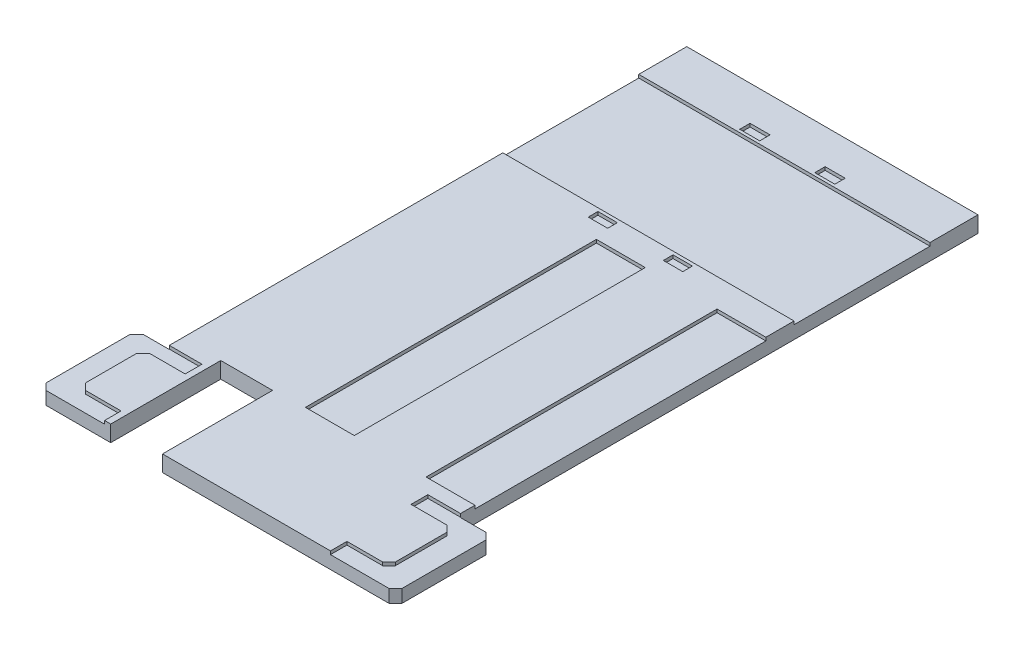
from build123d import *

# Parameters (mm, degrees)
SKETCH1_W           = 90
SKETCH1_H           = 190
BOSS_EXTRUDE1_DEPTH = 5
SKETCH2_W           = 10
SKETCH2_H           = 30
BOSS_EXTRUDE2_DEPTH = 5
CHAMFER1_SIZE       = 2
SKETCH3_W           = 16
SKETCH3_H           = 34
CUT_EXTRUDE1_DEPTH  = 50
SKETCH4_W           = 90
SKETCH4_H           = 42
CUT_EXTRUDE2_DEPTH  = 1
CUT_EXTRUDE5_START  = 5
SKETCH5_W           = 6
SKETCH5_H           = 3
CUT_EXTRUDE5_DEPTH  = 1
SKETCH6_W           = 6.2
SKETCH6_H           = 3.2
CUT_EXTRUDE6_DEPTH  = 1
SKETCH7_W           = 15.1
SKETCH7_H           = 89.916335477
CUT_EXTRUDE7_DEPTH  = 1
CUT_EXTRUDE8_DEPTH  = 1


with BuildPart() as part:
    # Sketch1 → Boss-Extrude1 (new body)
    with BuildSketch(Plane(origin=(0, 0, 0), x_dir=(1, 0, 0), z_dir=(0, 1, 0))):
        Rectangle(SKETCH1_W, SKETCH1_H)
    extrude(amount=BOSS_EXTRUDE1_DEPTH)

    # Sketch2 → Boss-Extrude2 (add)
    with BuildSketch(Plane(origin=(0, 0, 0), x_dir=(1, 0, 0), z_dir=(0, 1, 0))):
        with Locations((-50, -80)):
            Rectangle(SKETCH2_W, SKETCH2_H)
        with Locations((50, -80)):
            Rectangle(SKETCH2_W, SKETCH2_H)
    extrude(amount=BOSS_EXTRUDE2_DEPTH)

    # Chamfer1
    chamfer1_edges = [part.edges().sort_by_distance(p)[0] for p in [
        (-55, 2.5, 65),
        (-55, 2.5, 95),
        (55, 2.5, 95),
        (55, 2.5, 65),
    ]]
    chamfer(chamfer1_edges, length=CHAMFER1_SIZE)

    # Sketch3 → Cut-Extrude1 (cut)
    with BuildSketch(Plane(origin=(0, 5, 0), x_dir=(1, 0, 0), z_dir=(0, 1, 0))):
        with Locations((-25, -78)):
            Rectangle(SKETCH3_W, SKETCH3_H)
    extrude(amount=-CUT_EXTRUDE1_DEPTH, mode=Mode.SUBTRACT)

    # Sketch4 → Cut-Extrude2 (cut)
    with BuildSketch(Plane(origin=(0, 5, 0), x_dir=(1, 0, 0), z_dir=(0, 1, 0))):
        with Locations((0, 59.159820088)):
            Rectangle(SKETCH4_W, SKETCH4_H)
    extrude(amount=-CUT_EXTRUDE2_DEPTH, mode=Mode.SUBTRACT)

    # Sketch5 → Cut-Extrude5 (cut)
    with BuildSketch(Plane(origin=(0, 0, 0), x_dir=(1, 0, 0), z_dir=(0, 1, 0)).offset(CUT_EXTRUDE5_START)):
        with Locations((-11.605, 35.659820088)):
            Rectangle(SKETCH5_W, SKETCH5_H)
        with Locations((-11.605, 82.659820088)):
            Rectangle(SKETCH5_W, SKETCH5_H)
        with Locations((11.605, 35.659820088)):
            Rectangle(SKETCH5_W, SKETCH5_H)
        with Locations((11.605, 82.659820088)):
            Rectangle(SKETCH5_W, SKETCH5_H)
    extrude(amount=-CUT_EXTRUDE5_DEPTH, mode=Mode.SUBTRACT)

    # Sketch6 → Cut-Extrude6 (cut)
    with BuildSketch(Plane(origin=(0, 5, 0), x_dir=(1, 0, 0), z_dir=(0, 1, 0))):
        with Locations((11.605, 82.659820088)):
            Rectangle(SKETCH6_W, SKETCH6_H)
        with Locations((-11.605, 82.659820088)):
            Rectangle(SKETCH6_W, SKETCH6_H)
    extrude(amount=-CUT_EXTRUDE6_DEPTH, mode=Mode.SUBTRACT)

    # Sketch7 → Cut-Extrude7 (cut)
    with BuildSketch(Plane(origin=(0, 5, 0), x_dir=(1, 0, 0), z_dir=(0, 1, 0))):
        with Locations((37.45, -15.495273531)):
            Rectangle(SKETCH7_W, SKETCH7_H)
        with Locations((0.16773297, -15.495273531)):
            Rectangle(SKETCH7_W, SKETCH7_H)
    extrude(amount=-CUT_EXTRUDE7_DEPTH, mode=Mode.SUBTRACT)

    # Sketch8 → Cut-Extrude8 (cut)
    with BuildSketch(Plane(origin=(0, 5, 0), x_dir=(1, 0, 0), z_dir=(0, 1, 0))):
        Polygon((-34.9, -70.1), (-45.958578644, -70.1), (-47.9, -72.041421356), (-47.9, -87.958578644), (-45.958578644, -89.9), (-34.9, -89.9), (-34.9, -95.1), (-53.041421356, -95.1), (-55.1, -93.041421356), (-55.1, -66.958578644), (-53.041421356, -64.9), (-34.9, -64.9), align=None)
    cut_extrude8 = extrude(amount=-CUT_EXTRUDE8_DEPTH, mode=Mode.SUBTRACT)

    # Mirror1: Cut-Extrude8 across plane
    add(cut_extrude8.mirror(Plane(origin=(0, 0, 0), x_dir=(0, 0, 1), z_dir=(1, 0, 0))), mode=Mode.SUBTRACT)


solid = part.part
